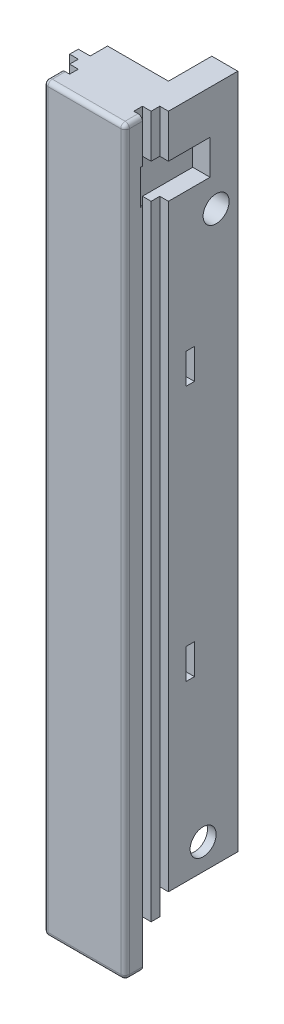
from build123d import *

# Parameters (mm, degrees)
SKETCH1_W           = 9.4
SKETCH1_H           = 2
BOSS_EXTRUDE1_DEPTH = 85.5
BOSS_EXTRUDE2_DEPTH = 81
FILLET1_R           = 0.5
BOSS_EXTRUDE3_DEPTH = 78
SKETCH2_R           = 1.5
CUT_EXTRUDE1_DEPTH  = 87.643786319
CUT_EXTRUDE2_REACH  = 88.644
SKETCH2_3_W         = 4.8
SKETCH2_3_H         = 4
SKETCH2_3_W_2       = 2.2
SKETCH3_W           = 2
SKETCH3_H           = 63
CUT_EXTRUDE3_DEPTH  = 5
SKETCH4_W           = 1
SKETCH4_H           = 3.5
CUT_EXTRUDE4_DEPTH  = 2


with BuildPart() as part:
    # Sketch1 → Boss-Extrude1 (new body)
    with BuildSketch(Plane(origin=(0, 0, 0), x_dir=(1, 0, 0), z_dir=(0, 1, 0))):
        with Locations((0.278560628, 2.818575451)):
            Rectangle(SKETCH1_W, SKETCH1_H)
    extrude(amount=-BOSS_EXTRUDE1_DEPTH)

    # Sketch1<3> → Boss-Extrude2 (add)
    with BuildSketch(Plane(origin=(0, 0, 0), x_dir=(1, 0, 0), z_dir=(0, 1, 0))):
        Polygon((3.978560628, 1.818575451), (-3.421439372, 1.818575451), (-3.421439372, 0.818575451), (-4.421439372, 0.818575451), (-4.421439372, -0.181424549), (4.978560628, -0.181424549), (4.978560628, 0.818575451), (3.978560628, 0.818575451), align=None)
    extrude(amount=-BOSS_EXTRUDE2_DEPTH)

    # Fillet1
    fillet1_edges = [part.edges().sort_by_distance(p)[0] for p in [
        (-4.421439372, -85.5, -2.818575451),
        (4.978560628, -85.5, -2.818575451),
        (-4.421439372, 0, -2.818575451),
        (0.278560628, 0, -3.818575451),
        (4.978560628, 0, -2.818575451),
        (-4.421439372, -42.75, -3.818575451),
        (4.978560628, -42.75, -3.818575451),
        (0.278560628, -85.5, -3.818575451),
    ]]
    fillet(fillet1_edges, radius=FILLET1_R)

    # Sketch1<4> → Boss-Extrude3 (add)
    with BuildSketch(Plane(origin=(0, 0, 0), x_dir=(1, 0, 0), z_dir=(0, 1, 0))):
        Polygon((-5.421439372, -0.181424549), (-4.421439372, -0.181424549), (4.978560628, -0.181424549), (5.978560628, -0.181424549), (5.978560628, -8.181424549), (2.978560628, -8.181424549), (2.978560628, -3.181424549), (-4.050977977, -3.181424549), (-4.050977977, -1.181424549), (-5.421439372, -1.181424549), align=None)
    extrude(amount=-BOSS_EXTRUDE3_DEPTH)

    # Sketch2 → Cut-Extrude1 (cut, through all)
    with BuildSketch(Plane(origin=(5.978560628, 0, 0), x_dir=(0, 0, -1), z_dir=(1, 0, 0))):
        with Locations((-5.681424549, -12.5)):
            Circle(SKETCH2_R)
        with Locations((-4.181424549, -75)):
            Circle(SKETCH2_R)
    extrude(amount=-CUT_EXTRUDE1_DEPTH, mode=Mode.SUBTRACT)

    # Cut-Extrude2: up to this face of the body (flat: up to its plane)
    cut_extrude2_end = Plane(part.part.faces().sort_by_distance((3.978560628, -40.5, -1.318575451))[0])
    # Sketch2<3> → Cut-Extrude2 (cut, up to the picked face)
    with BuildSketch(Plane(origin=(5.978560628, 0, 0), x_dir=(0, 0, -1), z_dir=(1, 0, 0)), mode=Mode.PRIVATE) as cut_extrude2_sk1:
        with Locations((-2.581424549, -7)):
            Rectangle(SKETCH2_3_W, SKETCH2_3_H)
    cut_extrude2_tool1 = split(extrude(cut_extrude2_sk1.sketch, amount=-CUT_EXTRUDE2_REACH, mode=Mode.PRIVATE), bisect_by=cut_extrude2_end, keep=Keep.BOTH, mode=Mode.PRIVATE)
    # Sketch2<3> → Cut-Extrude2 (cut, up to the picked face)
    with BuildSketch(Plane(origin=(5.978560628, 0, 0), x_dir=(0, 0, -1), z_dir=(1, 0, 0)), mode=Mode.PRIVATE) as cut_extrude2_sk2:
        with Locations((0.918575451, -7)):
            Rectangle(SKETCH2_3_W_2, SKETCH2_3_H)
    cut_extrude2_tool2 = split(extrude(cut_extrude2_sk2.sketch, amount=-CUT_EXTRUDE2_REACH, mode=Mode.PRIVATE), bisect_by=cut_extrude2_end, keep=Keep.BOTH, mode=Mode.PRIVATE)
    add(cut_extrude2_tool1.solids().sort_by(Axis((5.978561, -7, 2.581425), (-1, 0, 0)))[0], mode=Mode.SUBTRACT)
    add(cut_extrude2_tool2.solids().sort_by(Axis((5.978561, -7, -0.918575), (-1, 0, 0)))[0], mode=Mode.SUBTRACT)

    # Sketch3 → Cut-Extrude3 (cut)
    with BuildSketch(Plane.XY.offset(8.181424549)):
        with Locations((3.978560628, -46.5)):
            Rectangle(SKETCH3_W, SKETCH3_H)
    extrude(amount=-CUT_EXTRUDE3_DEPTH, mode=Mode.SUBTRACT)

    # Sketch4 → Cut-Extrude4 (cut)
    with BuildSketch(Plane(origin=(5.978560628, 0, 0), x_dir=(0, 0, -1), z_dir=(1, 0, 0))):
        with Locations((-2.681424549, -26.75)):
            Rectangle(SKETCH4_W, SKETCH4_H)
        with Locations((-2.681424549, -56.25)):
            Rectangle(SKETCH4_W, SKETCH4_H)
    extrude(amount=-CUT_EXTRUDE4_DEPTH, mode=Mode.SUBTRACT)


with BuildPart() as body_2:
    # Mirror1: mirrored copy
    add(part.part.mirror(Plane(origin=(0, 0, -13.818575451), x_dir=(1, 0, 0), z_dir=(0, 0, -1))))


solid = body_2.part
